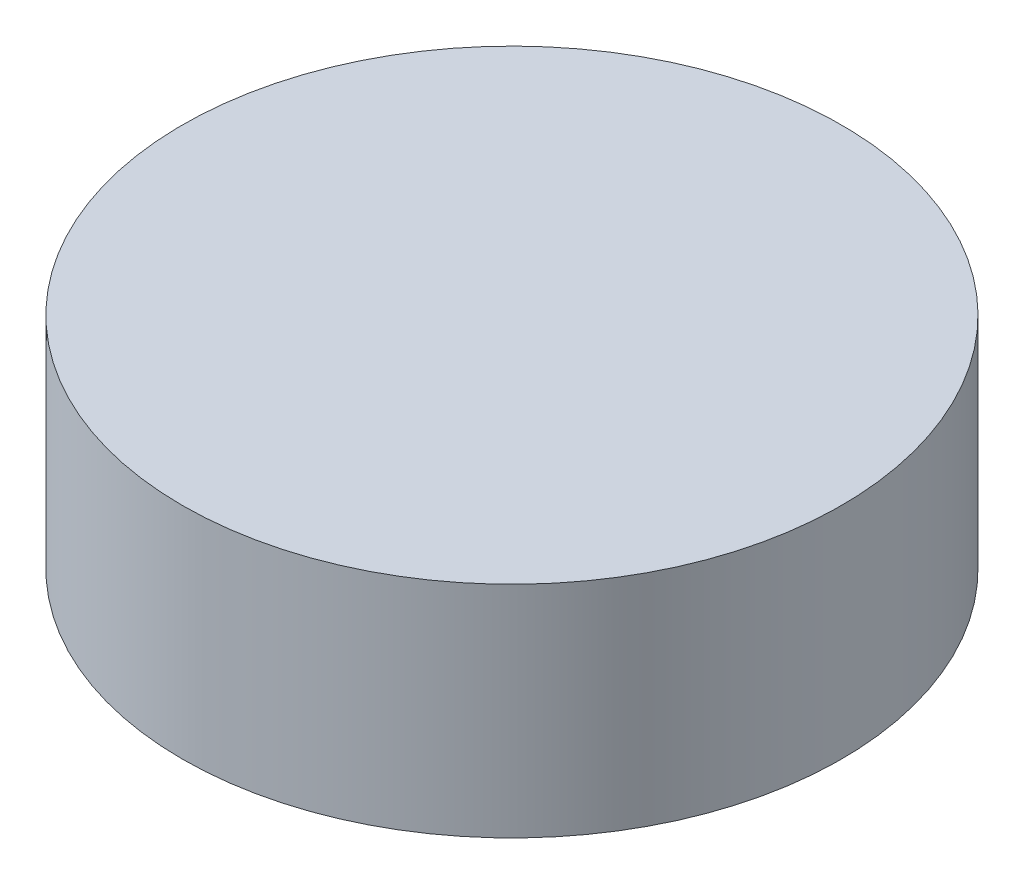
from build123d import *

# Parameters (mm, degrees)
SKETCH1_R           = 30
BOSS_EXTRUDE1_DEPTH = 10
SKETCH2_R           = 19
CUT_EXTRUDE1_DEPTH  = 15


with BuildPart() as part:
    # Sketch1 → Boss-Extrude1 (new, symmetric)
    with BuildSketch(Plane(origin=(0, 0, 0), x_dir=(1, 0, 0), z_dir=(0, 1, 0))):
        with Locations(Location((0, 0, 0), (0, 0, 270))):
            Circle(SKETCH1_R)
    extrude(amount=BOSS_EXTRUDE1_DEPTH, both=True)

    # Sketch2 → Cut-Extrude1 (cut)
    with BuildSketch(Plane.XZ.offset(10)):
        with Locations(Location((0, 0, 0), (0, 0, 270))):
            Circle(SKETCH2_R)
    extrude(amount=-CUT_EXTRUDE1_DEPTH, mode=Mode.SUBTRACT)


solid = part.part
